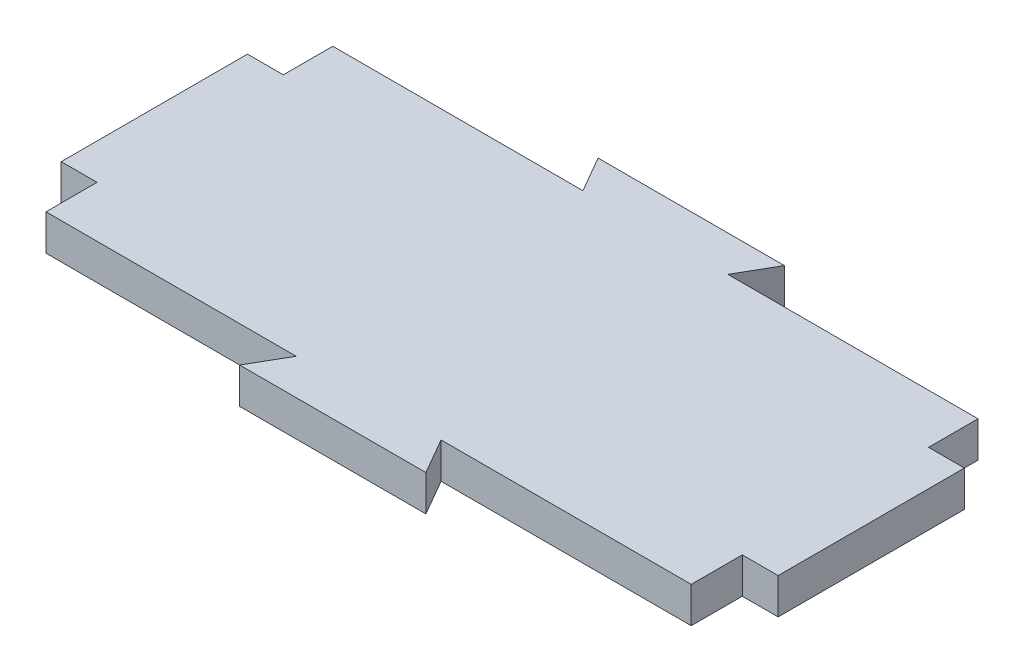
from build123d import *

# Parameters (mm, degrees)
BOSS_EXTRUDE1_DEPTH = 5


with BuildPart() as part:
    # Sketch2 → Boss-Extrude1 (new body)
    with BuildSketch(Plane(origin=(0, 0, 0), x_dir=(-1, 0, 0), z_dir=(0, 1, 0))):
        Polygon((45, 20), (10.103629711, 20), (12.990381057, 25), (-12.990381057, 25), (-10.103629711, 20), (-45, 20), (-45, 12.876959441), (-50, 12.876959441), (-50, -13.103802672), (-45, -13.103802672), (-45, -20), (-10.103629711, -20), (-12.990381057, -25), (12.990381057, -25), (10.103629711, -20), (45, -20), (45, -13.103802672), (50, -13.103802672), (50, 12.876959441), (45, 12.876959441), align=None)
    extrude(amount=BOSS_EXTRUDE1_DEPTH)


solid = part.part
